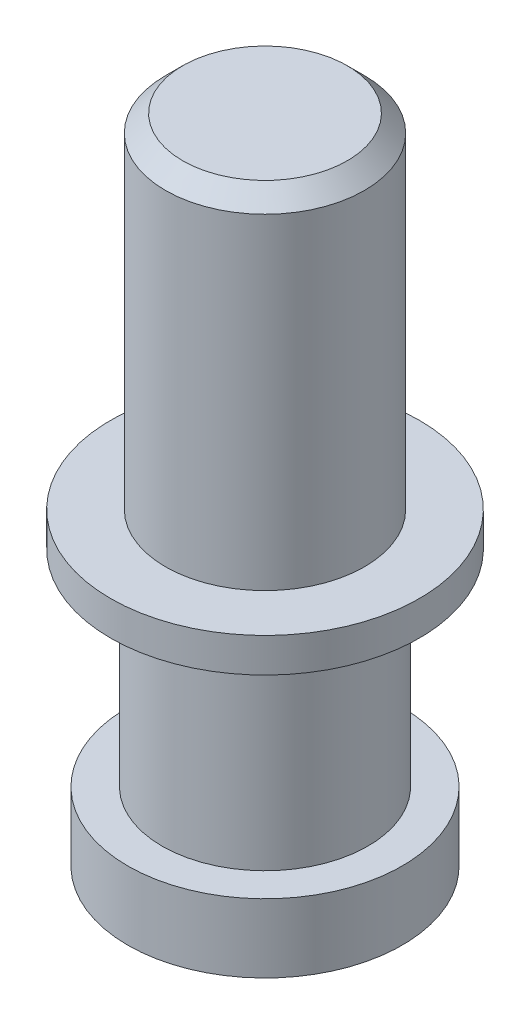
from build123d import *

# Parameters (mm, degrees)
SKETCH2_R           = 2
BOSS_EXTRUDE1_DEPTH = 1
SKETCH3_R           = 1.5
BOSS_EXTRUDE2_DEPTH = 3
SKETCH4_R           = 2.25
BOSS_EXTRUDE3_DEPTH = 0.5
SKETCH5_R           = 1.45
BOSS_EXTRUDE4_DEPTH = 5
CHAMFER3_SIZE       = 0.25


with BuildPart() as part:
    # Sketch2 → Boss-Extrude1 (new body)
    with BuildSketch(Plane(origin=(0, 0, 0), x_dir=(1, 0, 0), z_dir=(0, 1, 0))):
        with Locations(Location((0, 0, 0), (0, 0, 270))):
            Circle(SKETCH2_R)
    extrude(amount=BOSS_EXTRUDE1_DEPTH)

    # Sketch3 → Boss-Extrude2 (add)
    with BuildSketch(Plane(origin=(0, 1, 0), x_dir=(1, 0, 0), z_dir=(0, 1, 0))):
        with Locations(Location((0, 0, 0), (0, 0, 270))):
            Circle(SKETCH3_R)
    extrude(amount=BOSS_EXTRUDE2_DEPTH)

    # Sketch4 → Boss-Extrude3 (add)
    with BuildSketch(Plane(origin=(0, 4, 0), x_dir=(1, 0, 0), z_dir=(0, 1, 0))):
        with Locations(Location((0, 0, 0), (0, 0, 270))):
            Circle(SKETCH4_R)
    extrude(amount=BOSS_EXTRUDE3_DEPTH)

    # Sketch5 → Boss-Extrude4 (add)
    with BuildSketch(Plane(origin=(0, 4.5, 0), x_dir=(1, 0, 0), z_dir=(0, 1, 0))):
        with Locations(Location((0, 0, 0), (0, 0, 270))):
            Circle(SKETCH5_R)
    extrude(amount=BOSS_EXTRUDE4_DEPTH)

    # Chamfer3
    chamfer3_edges = [part.edges().sort_by_distance(p)[0] for p in [
        (0, 9.5, -1.45),
    ]]
    chamfer(chamfer3_edges, length=CHAMFER3_SIZE)


solid = part.part
